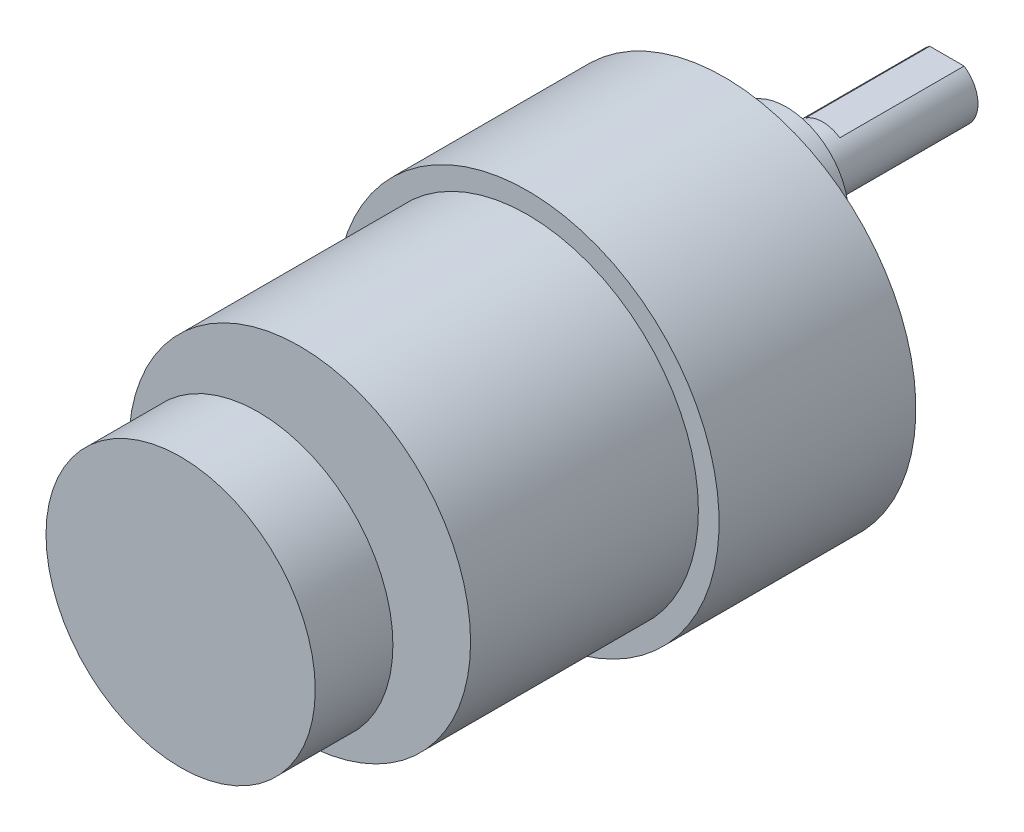
from build123d import *

# Parameters (mm, degrees)
SKETCH1_R           = 16.5
BOSS_EXTRUDE1_DEPTH = 22
SKETCH2_R           = 18.5
BOSS_EXTRUDE2_DEPTH = 19
SKETCH3_R           = 6
BOSS_EXTRUDE3_DEPTH = 6
SKETCH4_R           = 3
BOSS_EXTRUDE4_DEPTH = 15.5
CUT_EXTRUDE1_DEPTH  = 12
SKETCH6_R           = 1.5
CUT_EXTRUDE2_DEPTH  = 5
BOSS_EXTRUDE5_START = 4
SKETCH7_R           = 13
BOSS_EXTRUDE5_DEPTH = 7.5
SKETCH8_W           = 2
SKETCH8_H           = 5
BOSS_EXTRUDE6_DEPTH = 4


with BuildPart() as part:
    # Sketch1 → Boss-Extrude1 (new body)
    with BuildSketch(Plane.XY):
        Circle(SKETCH1_R)
    extrude(amount=BOSS_EXTRUDE1_DEPTH)

    # Sketch2 → Boss-Extrude2 (add)
    with BuildSketch(Plane(origin=(0, 0, 0), x_dir=(-1, 0, 0), z_dir=(0, 0, -1))):
        Circle(SKETCH2_R)
    extrude(amount=BOSS_EXTRUDE2_DEPTH)

    # Sketch3 → Boss-Extrude3 (add)
    with BuildSketch(Plane(origin=(0, 0, -19), x_dir=(-1, 0, 0), z_dir=(0, 0, -1))):
        with Locations((0, 7)):
            Circle(SKETCH3_R)
    extrude(amount=BOSS_EXTRUDE3_DEPTH)

    # Sketch4 → Boss-Extrude4 (add)
    with BuildSketch(Plane(origin=(0, 0, -25), x_dir=(-1, 0, 0), z_dir=(0, 0, -1))):
        with Locations((0, 7)):
            Circle(SKETCH4_R)
    extrude(amount=BOSS_EXTRUDE4_DEPTH)

    # Sketch5 → Cut-Extrude1 (cut)
    with BuildSketch(Plane(origin=(0, 0, -40.5), x_dir=(-1, 0, 0), z_dir=(0, 0, -1))):
        Polygon((-80.661429966, 9.5), (-1.658312395, 9.5), (1.658312395, 9.5), (80.661429966, 9.5), (80.661429966, 167.506235142), (-80.661429966, 167.506235142), align=None)
    extrude(amount=-CUT_EXTRUDE1_DEPTH, mode=Mode.SUBTRACT)

    # Sketch6 → Cut-Extrude2 (cut)
    with BuildSketch(Plane(origin=(0, 0, -19), x_dir=(-1, 0, 0), z_dir=(0, 0, -1))):
        with Locations((-15.5, 0)):
            Circle(SKETCH6_R)
        with Locations((-7.75, 13.423393759)):
            Circle(SKETCH6_R)
        with Locations((7.75, 13.423393759)):
            Circle(SKETCH6_R)
        with Locations((15.5, 0)):
            Circle(SKETCH6_R)
        with Locations((7.75, -13.423393759)):
            Circle(SKETCH6_R)
        with Locations((-7.75, -13.423393759)):
            Circle(SKETCH6_R)
    extrude(amount=-CUT_EXTRUDE2_DEPTH, mode=Mode.SUBTRACT)



with BuildPart() as body_2:
    # Sketch7 → Boss-Extrude5 (new body)
    with BuildSketch(Plane.XY.offset(22).offset(BOSS_EXTRUDE5_START)):
        Circle(SKETCH7_R)
    extrude(amount=BOSS_EXTRUDE5_DEPTH)


with BuildPart() as part_1:
    add(part.part)

    add(body_2.part)  # Boss-Extrude6 merges body 2
    # Sketch8 → Boss-Extrude6 (add)
    with BuildSketch(Plane.XY.offset(22)):
        with Locations((-5.068135622, 0)):
            Rectangle(SKETCH8_W, SKETCH8_H)
        with Locations((5.068135622, 0)):
            Rectangle(SKETCH8_W, SKETCH8_H)
    extrude(amount=BOSS_EXTRUDE6_DEPTH)


solid = part_1.part
